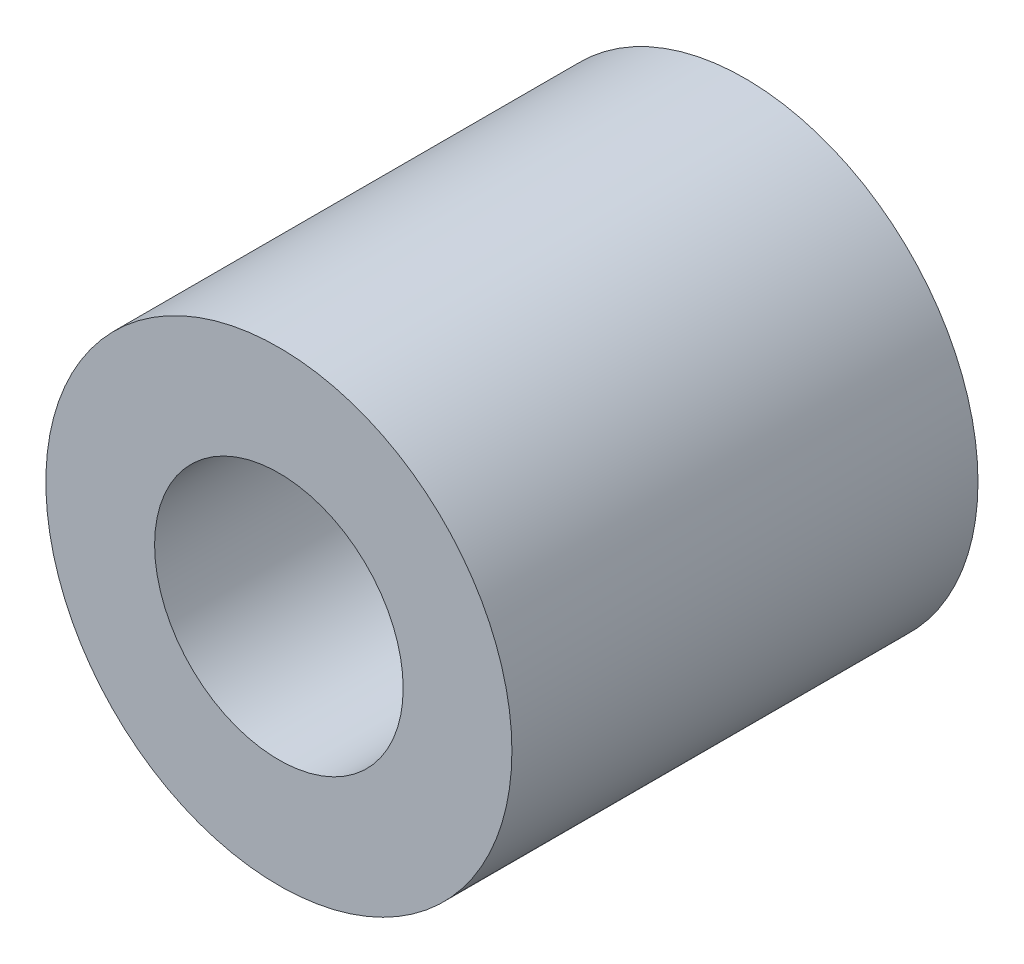
from build123d import *

# Parameters (mm, degrees)
SKETCH_1_R      = 3
SKETCH_1_R_2    = 1.6
EXTRUDE_1_DEPTH = 6


with BuildPart() as part:
    # ｽｹｯﾁ1 → ﾎﾞｽ - 押し出し1 (new body)
    with BuildSketch(Plane.XY):
        Circle(SKETCH_1_R)
        Circle(SKETCH_1_R_2, mode=Mode.SUBTRACT)
    extrude(amount=EXTRUDE_1_DEPTH)


solid = part.part
